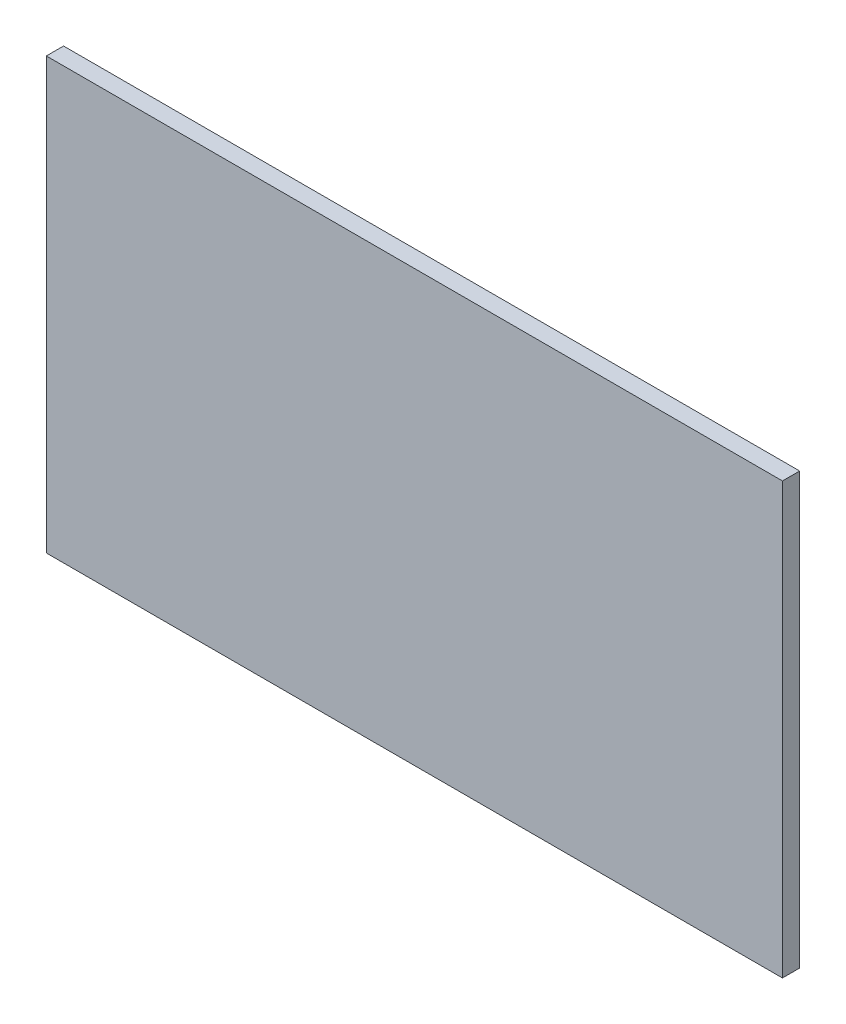
from build123d import *

# Parameters (mm, degrees)
SKETCH1_W           = 1710
SKETCH1_H           = 1000
BOSS_EXTRUDE1_DEPTH = 40


with BuildPart() as part:
    # Sketch1 → Boss-Extrude1 (new body)
    with BuildSketch(Plane.XY):
        with Locations((250, 0)):
            Rectangle(SKETCH1_W, SKETCH1_H)
    extrude(amount=BOSS_EXTRUDE1_DEPTH)


solid = part.part
